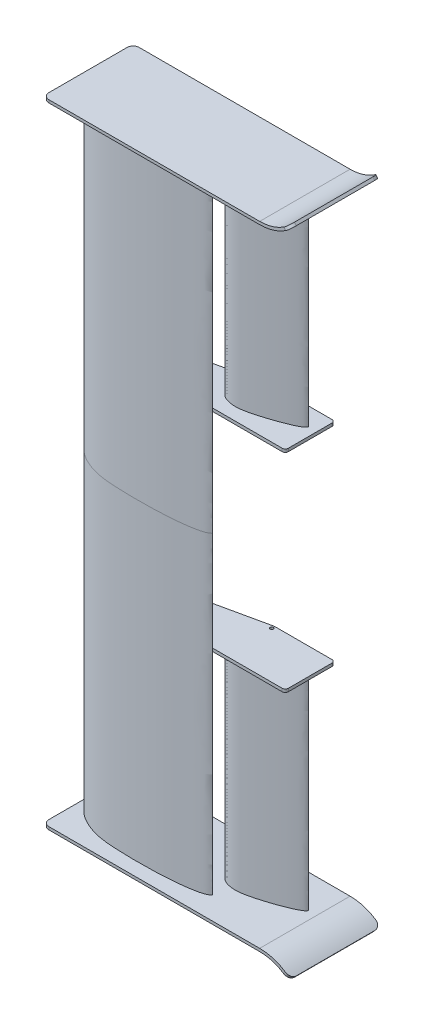
from build123d import *

# Parameters (mm, degrees)
MAIN_DEPTH           = 660.4
SKETCH2_W            = 457.2
SKETCH2_H            = 190.5
ENDPLATE_DEPTH       = 6
BOSS_EXTRUDE5_DEPTH  = 190.5
SECOND_DEPTH         = 438.15
FILLET1_R            = 12.7
SKETCH23_R           = 3.302
INNER_ENDPLATE_DEPTH = 6.35


with BuildPart() as part:
    # Sketch1 → Main (new body)
    with BuildSketch(Plane(origin=(0, 0, 0), x_dir=(1, 0, 0), z_dir=(0, 1, 0))):
        with BuildLine():
            add(Edge.make_bspline(
                [(310.463845492, 47.259196978), (310.46297359, 47.267154189), (309.216850446, 46.62700977), (307.846403769, 46.011621914), (304.280786948, 44.424374903), (299.511660944, 42.819520456), (292.908834256, 41.236182285), (284.923042944, 39.972954123), (275.644489423, 39.014698092), (265.252069182, 38.443565802), (253.872469203, 38.305788402), (241.656802549, 38.627289353), (228.754254336, 39.434871831), (215.32005764, 40.719492576), (201.50856161, 42.470686101), (187.473442857, 44.665547934), (173.364437285, 47.25968123), (159.325903947, 50.201123123), (145.496363264, 53.441082277), (131.99983953, 56.894935575), (118.953330114, 60.495905864), (106.462486038, 64.157557775), (94.617618501, 67.797629829), (83.4977432, 71.324265433), (73.163504455, 74.640170192), (63.660367209, 77.687906441), (54.913724574, 80.261388665), (46.874573966, 82.320744222), (39.569919329, 84.053436628), (33.038043207, 85.472768156), (27.344856515, 86.556633324), (22.561047583, 87.352830974), (18.720381113, 87.686545767), (15.907915607, 87.890034883), (13.707636154, 87.155445312), (12.904324703, 85.231304501), (12.543398672, 83.070326582), (12.720649738, 80.44131285), (13.411931261, 77.531851422), (14.663339536, 74.403421576), (16.474422985, 71.123489385), (18.944942436, 67.774181889), (22.064577576, 64.383148263), (25.778862268, 60.924210695), (30.093795664, 57.460311883), (34.984896224, 54.034229147), (40.427577674, 50.681123894), (46.409926242, 47.457003136), (52.894509487, 44.379799377), (59.859018498, 41.505638203), (67.277272675, 38.873528205), (75.152968187, 36.57860894), (83.48761162, 34.617106723), (92.326095184, 33.070584061), (101.667355208, 31.901790166), (111.472438276, 30.937070462), (121.697209455, 30.231149487), (132.277617837, 29.72941602), (143.148654301, 29.397410733), (154.227925709, 29.18899276), (165.423707209, 29.09390494), (176.640705512, 29.091626097), (187.791742422, 29.202537859), (198.796770867, 29.431717071), (209.5849735, 29.775340643), (220.088273252, 30.244993817), (230.244632232, 30.825665152), (239.991165213, 31.522447797), (249.26943499, 32.319237716), (258.023009293, 33.213008254), (266.19964691, 34.197878974), (273.752108338, 35.26525725), (280.637812582, 36.40206553), (286.818418039, 37.603705661), (292.26101434, 38.857203766), (296.939654579, 40.152174252), (300.844413379, 41.463824945), (304.033686798, 42.920117293), (306.423297262, 44.459457329), (308.469209008, 45.930997418), (309.396522327, 46.641914263), (310.464700022, 47.251398314), (310.463845492, 47.259196978)],
                knots=[0, 0, 0, 0, 0.000999594, 0.004147435, 0.009748209, 0.018044377, 0.028864178, 0.04183079, 0.056713807, 0.073341232, 0.091507989, 0.111021837, 0.131661709, 0.153207715, 0.175433402, 0.198110317, 0.221011446, 0.243905882, 0.266573311, 0.288810349, 0.310405036, 0.331177743, 0.350943876, 0.3695564, 0.386864963, 0.402753039, 0.417195876, 0.430379519, 0.442362633, 0.453032156, 0.462284346, 0.470026206, 0.476176645, 0.480649947, 0.483553073, 0.486420689, 0.489953231, 0.494096927, 0.498850588, 0.50419675, 0.510125492, 0.516691031, 0.524011699, 0.532092122, 0.540897921, 0.550403414, 0.560581041, 0.571396483, 0.582828081, 0.594829641, 0.607347037, 0.620384325, 0.633968937, 0.648199967, 0.663193937, 0.678898581, 0.695226562, 0.712113221, 0.729459406, 0.747143117, 0.765009772, 0.782904928, 0.800688045, 0.818242105, 0.835449083, 0.852211621, 0.868429578, 0.884009363, 0.898854951, 0.912881827, 0.92601075, 0.938166771, 0.949289699, 0.959322172, 0.968216949, 0.97594822, 0.982474409, 0.987904723, 0.992516501, 0.996351138, 0.999020322, 1, 1, 1, 1], degree=3))
        make_face()
    extrude(amount=MAIN_DEPTH)


with BuildPart() as body_2:
    # Sketch2 → Endplate (new body)
    with BuildSketch(Plane(origin=(0, 660.4, 0), x_dir=(1, 0, 0), z_dir=(0, 1, 0))):
        with Locations((228.6, 95.25)):
            Rectangle(SKETCH2_W, SKETCH2_H)
    extrude(amount=ENDPLATE_DEPTH)

    # Sketch5 → Boss-Extrude5 (add)
    with BuildSketch(Plane(origin=(0, 0, -190.5), x_dir=(-1, 0, 0), z_dir=(0, 0, -1))):
        with BuildLine():
            Line((-521.851638269, 684.5445342), (-517.918692866, 689.07575263))
            ThreePointArc((-517.918692866, 689.07575263), (-489.607365755, 672.253910326), (-457.2, 666.4))
            Line((-457.2, 666.4), (-457.2, 660.4))
            ThreePointArc((-457.2, 660.4), (-491.706495268, 666.633086962), (-521.851638269, 684.5445342))
        make_face()
    extrude(amount=-BOSS_EXTRUDE5_DEPTH)

    # Fillet1
    fillet1_edges = [body_2.edges().sort_by_distance(p)[0] for p in [
        (519.885165568, 686.810143415, -190.5),
        (519.885165568, 686.810143415, 0),
        (0, 663.4, -190.5),
        (0, 663.4, 0),
    ]]
    fillet(fillet1_edges, radius=FILLET1_R)


with BuildPart() as body_3:
    # Sketch3 → Second (new body)
    with BuildSketch(Plane(origin=(0, 660.4, 0), x_dir=(1, 0, 0), z_dir=(0, 1, 0))):
        with BuildLine():
            add(Edge.make_bspline(
                [(439.821162952, 120.02722665), (439.819582818, 120.030903949), (439.317326131, 119.542651799), (438.752004792, 119.048062717), (437.279129687, 117.76787405), (435.233367762, 116.30333033), (432.30767212, 114.581013571), (428.6739131, 112.809588311), (424.377434144, 110.995002656), (419.491765154, 109.202689583), (414.07072347, 107.473274469), (408.182774521, 105.841243271), (401.895333277, 104.341220746), (395.283946802, 102.991575714), (388.423947414, 101.809867743), (381.392164259, 100.80761035), (374.266684107, 99.985464349), (367.124128818, 99.339686823), (360.037864863, 98.867197804), (353.079565457, 98.545665146), (346.314935044, 98.360262553), (339.80712654, 98.285105434), (333.611347925, 98.294062486), (327.778808875, 98.354763237), (322.352729681, 98.429551483), (317.363246088, 98.4976096), (312.80481142, 98.449490836), (308.659823792, 98.258966509), (304.913790691, 98.019620339), (301.583072401, 97.743409206), (298.702415893, 97.429398564), (296.298633444, 97.110777177), (294.413425257, 96.708892598), (293.038890957, 96.395048735), (292.094208707, 95.722153258), (291.991385591, 94.684687984), (292.13471235, 93.598648974), (292.603789982, 92.367491404), (293.359649985, 91.077381083), (294.415346011, 89.764453098), (295.760799552, 88.460900499), (297.431705674, 87.220576146), (299.419087775, 86.055191876), (301.70072957, 84.944268526), (304.270298234, 83.918779289), (307.109834423, 82.995599386), (310.20244205, 82.187947162), (313.534237085, 81.52086088), (317.084699638, 80.997442914), (320.834957885, 80.6412686), (324.766791004, 80.467162755), (328.868058269, 80.521156912), (333.14003172, 80.801666917), (337.592253387, 81.354254682), (342.229660213, 82.160953161), (347.059012371, 83.133034566), (352.051206684, 84.290213663), (357.183600446, 85.59701463), (362.430146858, 87.027457244), (367.758194587, 88.54743443), (373.125384629, 90.138632824), (378.489152176, 91.777309647), (383.804833261, 93.460466206), (389.033411023, 95.178828254), (394.141582861, 96.920215279), (399.095103965, 98.680214888), (403.866505229, 100.442580262), (408.424973386, 102.200553772), (412.74492073, 103.937892543), (416.799806491, 105.644899771), (420.565511046, 107.311126788), (424.020702834, 108.92555926), (427.146933405, 110.475719386), (429.926541815, 111.953803549), (432.345688489, 113.348797228), (434.393485081, 114.651941457), (436.068810013, 115.849930848), (437.380879344, 117.012487151), (438.298447534, 118.097853492), (439.061586758, 119.100557237), (439.401057842, 119.576043905), (439.822711602, 120.02362262), (439.821162952, 120.02722665)],
                knots=[0, 0, 0, 0, 0.000999594, 0.004147435, 0.009748209, 0.018044377, 0.028864178, 0.04183079, 0.056713807, 0.073341232, 0.091507989, 0.111021837, 0.131661709, 0.153207715, 0.175433402, 0.198110317, 0.221011446, 0.243905882, 0.266573311, 0.288810349, 0.310405036, 0.331177743, 0.350943876, 0.3695564, 0.386864963, 0.402753039, 0.417195876, 0.430379519, 0.442362633, 0.453032156, 0.462284346, 0.470026206, 0.476176645, 0.480649947, 0.483553073, 0.486420689, 0.489953231, 0.494096927, 0.498850588, 0.50419675, 0.510125492, 0.516691031, 0.524011699, 0.532092122, 0.540897921, 0.550403414, 0.560581041, 0.571396483, 0.582828081, 0.594829641, 0.607347037, 0.620384325, 0.633968937, 0.648199967, 0.663193937, 0.678898581, 0.695226562, 0.712113221, 0.729459406, 0.747143117, 0.765009772, 0.782904928, 0.800688045, 0.818242105, 0.835449083, 0.852211621, 0.868429578, 0.884009363, 0.898854951, 0.912881827, 0.92601075, 0.938166771, 0.949289699, 0.959322172, 0.968216949, 0.97594822, 0.982474409, 0.987904723, 0.992516501, 0.996351138, 0.999020322, 1, 1, 1, 1], degree=3))
        make_face()
    extrude(amount=-SECOND_DEPTH)

    # Sketch23 → Inner Endplate (add)
    with BuildSketch(Plane.XZ.offset(-222.25)):
        with BuildLine():
            Line((328.847802706, -158.604358345), (50.711551744, -97.986472487))
            ThreePointArc((50.711551744, -97.986472487), (45.716790556, -91.978628831), (50.330310781, -85.673293323))
            Line((50.330310781, -85.673293323), (161.611498988, -54.096156795))
            ThreePointArc((161.611498988, -54.096156795), (162.469869307, -53.915561417), (163.344937246, -53.854977615))
            Line((163.344937246, -53.854977615), (450.85, -53.854977615))
            ThreePointArc((450.85, -53.854977615), (455.340128061, -55.714849554), (457.2, -60.204977615))
            Line((457.2, -60.204977615), (457.2, -152.4))
            ThreePointArc((457.2, -152.4), (455.340128061, -156.890128061), (450.85, -158.75))
            Line((450.85, -158.75), (330.2, -158.75))
            ThreePointArc((330.2, -158.75), (329.51999099, -158.713484596), (328.847802706, -158.604358345))
        make_face()
        with Locations(Location((330.2, -152.4, 0), (0, 0, 270))):
            Circle(SKETCH23_R, mode=Mode.SUBTRACT)
        with Locations(Location((52.063749039, -91.782114142, 0), (0, 0, 270))):
            Circle(SKETCH23_R, mode=Mode.SUBTRACT)
        with Locations(Location((163.344937246, -60.204977615, 0), (0, 0, 270))):
            Circle(SKETCH23_R, mode=Mode.SUBTRACT)
    extrude(amount=INNER_ENDPLATE_DEPTH)


with BuildPart() as body_4:
    # Mirror1: mirrored copy
    add(body_2.part.mirror(Plane(origin=(13.675918577, 0, -76.987198967), x_dir=(0, 0, 1), z_dir=(0, -1, 0))))


with BuildPart() as body_5:
    # Mirror1 2: mirrored copy
    add(body_3.part.mirror(Plane(origin=(13.675918577, 0, -76.987198967), x_dir=(0, 0, 1), z_dir=(0, -1, 0))))


with BuildPart() as body_6:
    # Mirror1 3: mirrored copy
    add(part.part.mirror(Plane(origin=(13.675918577, 0, -76.987198967), x_dir=(0, 0, 1), z_dir=(0, -1, 0))))


solid = Compound([part.part, body_2.part, body_3.part, body_4.part, body_5.part, body_6.part])
